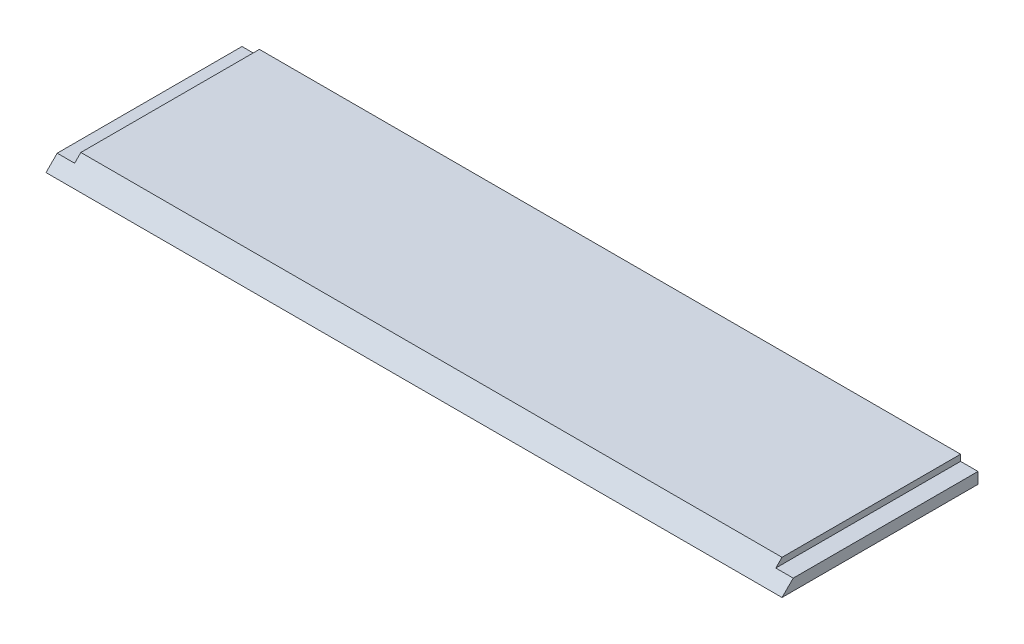
from build123d import *

# Parameters (mm, degrees)
SKETCH_1_W          = 118.3
SKETCH_1_H          = 31.5
EXTRUDE_1_DEPTH     = 2.8
CUT_EXTRUDE_1_DEPTH = 122.787422537
SKETCH_3_W          = 2.8
SKETCH_3_H          = 31.5
CUT_EXTRUDE_2_DEPTH = 1


with BuildPart() as part:
    # 草图1 → 凸台-拉伸1 (new body)
    with BuildSketch(Plane(origin=(0, 0, 0), x_dir=(1, 0, 0), z_dir=(0, 1, 0))):
        with Locations((4.649344978, 13.05010917)):
            Rectangle(SKETCH_1_W, SKETCH_1_H)
    extrude(amount=EXTRUDE_1_DEPTH)

    # 草图2 → 切除-拉伸1 (cut, through all)
    with BuildSketch(Plane(origin=(63.799344978, 0, 0), x_dir=(0, 0, -1), z_dir=(1, 0, 0))):
        Polygon((-2.69989083, 0), (-2.69989083, 2.8), (0.10010917, 2.8), align=None)
    extrude(amount=-CUT_EXTRUDE_1_DEPTH, mode=Mode.SUBTRACT)

    # 草图3 → 切除-拉伸2 (cut)
    with BuildSketch(Plane(origin=(0, 2.8, 0), x_dir=(1, 0, 0), z_dir=(0, 1, 0))):
        with Locations((-53.100655022, 13.05010917)):
            Rectangle(SKETCH_3_W, SKETCH_3_H)
        with Locations((62.399344978, 13.05010917)):
            Rectangle(SKETCH_3_W, SKETCH_3_H)
    extrude(amount=-CUT_EXTRUDE_2_DEPTH, mode=Mode.SUBTRACT)


solid = part.part
